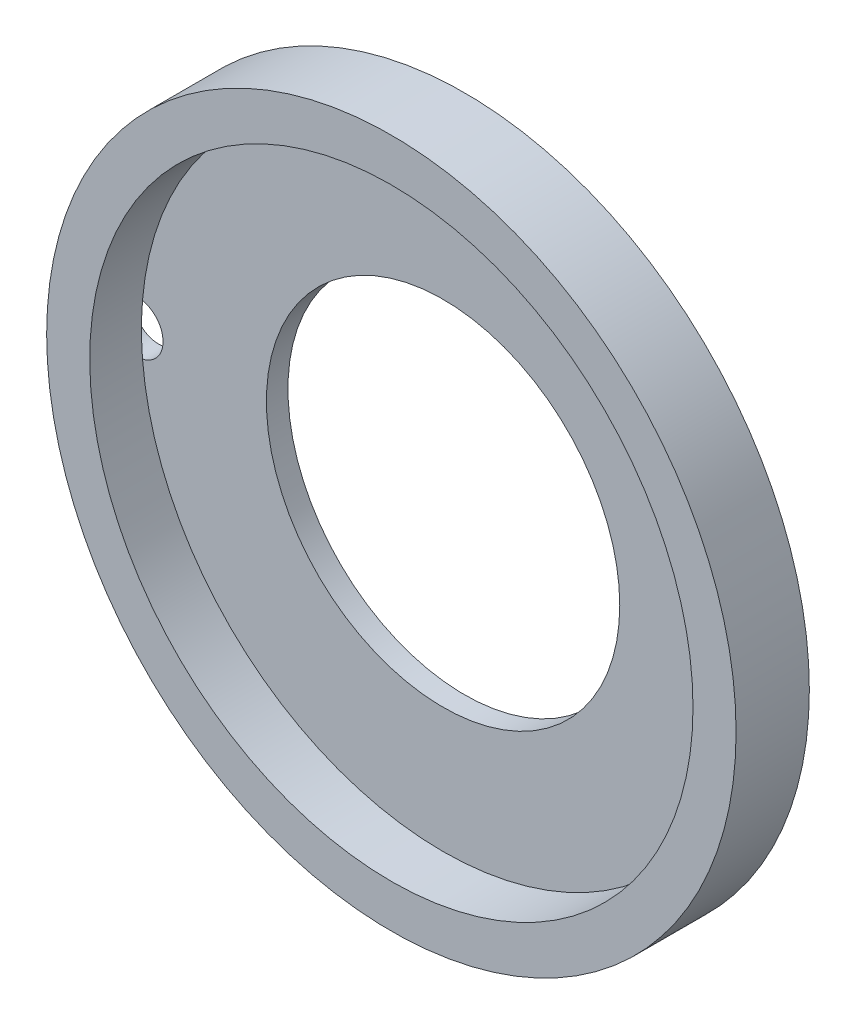
from build123d import *

# Parameters (mm, degrees)
OUTER_FLANGE_CONTACT_ANNULUS_ID8P2_START = -3
SKETCH1_R                                = 8
SKETCH1_R_2                              = 4.1
OUTER_FLANGE_CONTACT_ANNULUS_ID8P2_DEPTH = 0.5
M14X0P5_INTERNAL_THREAD_ENVELOPE_START   = -2.5
SKETCH2_R                                = 8
SKETCH2_R_2                              = 7
M14X0P5_INTERNAL_THREAD_ENVELOPE_DEPTH   = 1.2
SKETCH3_R                                = 0.6
TWO_PIN_WRENCH_HOLES_D1P2_DEPTH          = 0.5001


with BuildPart() as part:
    # Sketch1 → Outer_Flange_Contact_Annulus_ID8p2 (new body)
    with BuildSketch(Plane.XY.offset(OUTER_FLANGE_CONTACT_ANNULUS_ID8P2_START)):
        Circle(SKETCH1_R)
        Circle(SKETCH1_R_2, mode=Mode.SUBTRACT)
    extrude(amount=OUTER_FLANGE_CONTACT_ANNULUS_ID8P2_DEPTH)

    # Sketch2 → M14x0p5_Internal_Thread_Envelope (add)
    with BuildSketch(Plane.XY.offset(M14X0P5_INTERNAL_THREAD_ENVELOPE_START)):
        Circle(SKETCH2_R)
        Circle(SKETCH2_R_2, mode=Mode.SUBTRACT)
    extrude(amount=M14X0P5_INTERNAL_THREAD_ENVELOPE_DEPTH)

    # Sketch3 → Two_Pin_Wrench_Holes_D1p2 (cut)
    with BuildSketch(Plane(origin=(0, 0, -3), x_dir=(-1, 0, 0), z_dir=(0, 0, -1))):
        with Locations((7.1, 0)):
            Circle(SKETCH3_R)
        with Locations((-7.1, 0)):
            Circle(SKETCH3_R)
    extrude(amount=-TWO_PIN_WRENCH_HOLES_D1P2_DEPTH, mode=Mode.SUBTRACT)


solid = part.part
